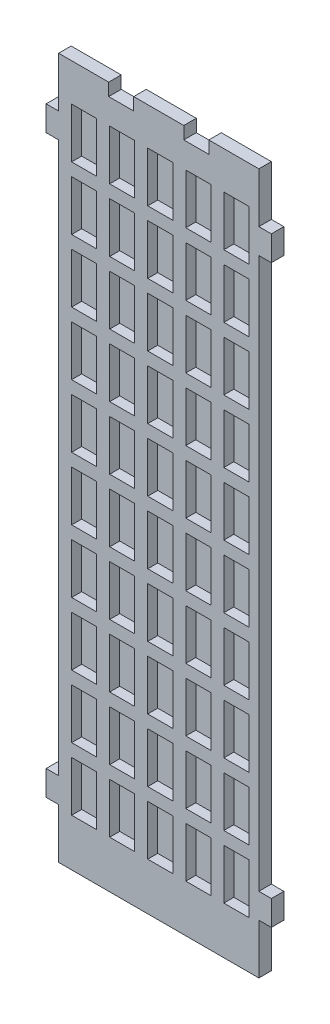
from build123d import *

# Parameters (mm, degrees)
BOSS_EXTRUDE1_DEPTH  = 3.175
SKETCH2_W            = 6.35
SKETCH2_H            = 12.7
CUT_EXTRUDE1_DEPTH   = 2.54
LPATTERN1_COUNT      = 5
LPATTERN1_PITCH      = 9.652
LPATTERN1_COUNT_DIR2 = 10
LPATTERN1_PITCH_DIR2 = 15.9512


with BuildPart() as part:
    # Sketch1 → Boss-Extrude1 (new body)
    with BuildSketch(Plane.XY):
        Polygon((31.75, 0), (19.05, 0), (19.05, -3.175), (12.7, -3.175), (12.7, 0), (0, 0), (0, -12.7), (-3.175, -12.7), (-3.175, -19.05), (0, -19.05), (0, -158.75), (-3.175, -158.75), (-3.175, -165.1), (0, -165.1), (0, -177.8), (12.7, -177.8), (38.1, -177.8), (50.8, -177.8), (50.8, -165.1), (53.975, -165.1), (53.975, -158.75), (50.8, -158.75), (50.8, -19.05), (53.975, -19.05), (53.975, -12.7), (50.8, -12.7), (50.8, 0), (38.1, 0), (38.1, -3.175), (31.75, -3.175), align=None)
    extrude(amount=BOSS_EXTRUDE1_DEPTH)

    # Sketch2 → Cut-Extrude1 (cut)
    with BuildSketch(Plane.XY.offset(3.175)):
        with Locations((6.477, -15.875)):
            Rectangle(SKETCH2_W, SKETCH2_H)
    cut_extrude1 = extrude(amount=-CUT_EXTRUDE1_DEPTH, mode=Mode.SUBTRACT)

    # LPattern1: Cut-Extrude1 5 × 10
    with Locations(*[(i * LPATTERN1_PITCH, -j * LPATTERN1_PITCH_DIR2, 0) for i in range(LPATTERN1_COUNT) for j in range(LPATTERN1_COUNT_DIR2) if (i, j) != (0, 0)]):
        add(cut_extrude1, mode=Mode.SUBTRACT)


solid = part.part
